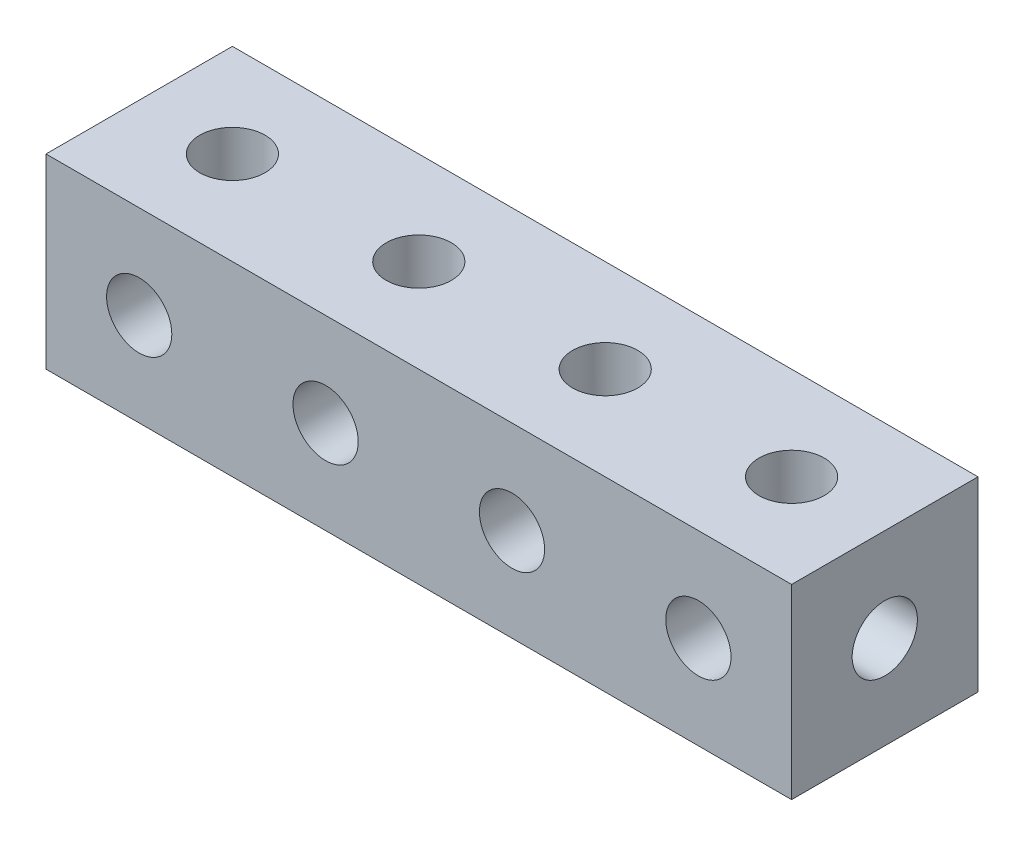
from build123d import *

# Parameters (mm, degrees)
ESQUISSE1_W             = 10
ESQUISSE1_H             = 10
BOSS_EXTRU_1_DEPTH      = 40
ESQUISSE2_R             = 1.75
ENL_V_MAT_EXTRU_1_DEPTH = 43.426406871
ESQUISSE3_R             = 1.75
ENL_V_MAT_EXTRU_2_DEPTH = 40
ESQUISSE4_R             = 1.75
ENL_V_MAT_EXTRU_3_DEPTH = 40


with BuildPart() as part:
    # Esquisse1 → Boss.-Extru.1 (new body)
    with BuildSketch(Plane(origin=(0, 0, 0), x_dir=(0, 0, -1), z_dir=(1, 0, 0))):
        with Locations((5, 5)):
            Rectangle(ESQUISSE1_W, ESQUISSE1_H)
    extrude(amount=BOSS_EXTRU_1_DEPTH)

    # Esquisse2 → Enlèv. mat.-Extru.1 (cut, through all)
    with BuildSketch(Plane(origin=(0, 10, 0), x_dir=(1, 0, 0), z_dir=(0, 1, 0))):
        with Locations(Location((5, 5, 0), (0, 0, 270))):
            Circle(ESQUISSE2_R)
        with Locations(Location((15, 5, 0), (0, 0, 270))):
            Circle(ESQUISSE2_R)
        with Locations(Location((25, 5, 0), (0, 0, 270))):
            Circle(ESQUISSE2_R)
        with Locations(Location((35, 5, 0), (0, 0, 270))):
            Circle(ESQUISSE2_R)
    extrude(amount=-ENL_V_MAT_EXTRU_1_DEPTH, mode=Mode.SUBTRACT)

    # Esquisse3 → Enlèv. mat.-Extru.2 (cut)
    with BuildSketch(Plane.XY):
        with Locations((5, 5)):
            Circle(ESQUISSE3_R)
        with Locations((15, 5)):
            Circle(ESQUISSE3_R)
        with Locations((25, 5)):
            Circle(ESQUISSE3_R)
        with Locations((35, 5)):
            Circle(ESQUISSE3_R)
    extrude(amount=-ENL_V_MAT_EXTRU_2_DEPTH, mode=Mode.SUBTRACT)

    # Esquisse4 → Enlèv. mat.-Extru.3 (cut)
    with BuildSketch(Plane(origin=(40, 0, 0), x_dir=(0, 0, -1), z_dir=(1, 0, 0))):
        with Locations(Location((5, 5, 0), (0, 0, 315))):
            Circle(ESQUISSE4_R)
    extrude(amount=-ENL_V_MAT_EXTRU_3_DEPTH, mode=Mode.SUBTRACT)


solid = part.part
